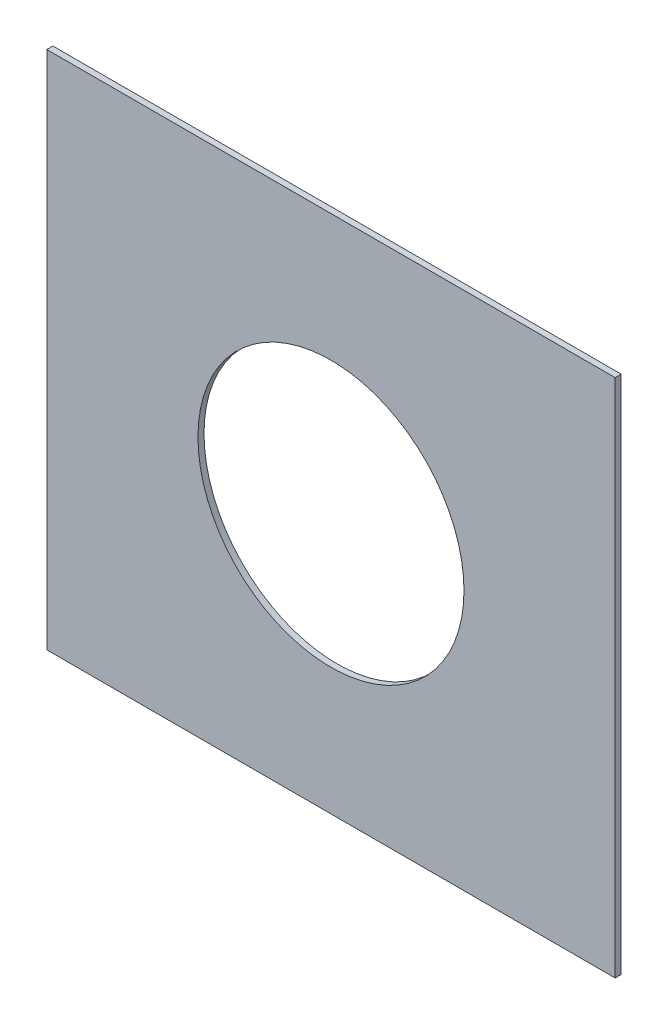
from build123d import *

# Parameters (mm, degrees)
SKETCH1_W           = 2350
SKETCH1_H           = 2150
BOSS_EXTRUDE1_DEPTH = 25
SKETCH2_R           = 550
CUT_EXTRUDE1_DEPTH  = 25


with BuildPart() as part:
    # Sketch1 → Boss-Extrude1 (new body)
    with BuildSketch(Plane.XY):
        Rectangle(SKETCH1_W, SKETCH1_H)
    extrude(amount=BOSS_EXTRUDE1_DEPTH)

    # Sketch2 → Cut-Extrude1 (cut)
    with BuildSketch(Plane.XY.offset(25)):
        Circle(SKETCH2_R)
    extrude(amount=-CUT_EXTRUDE1_DEPTH, mode=Mode.SUBTRACT)


solid = part.part
